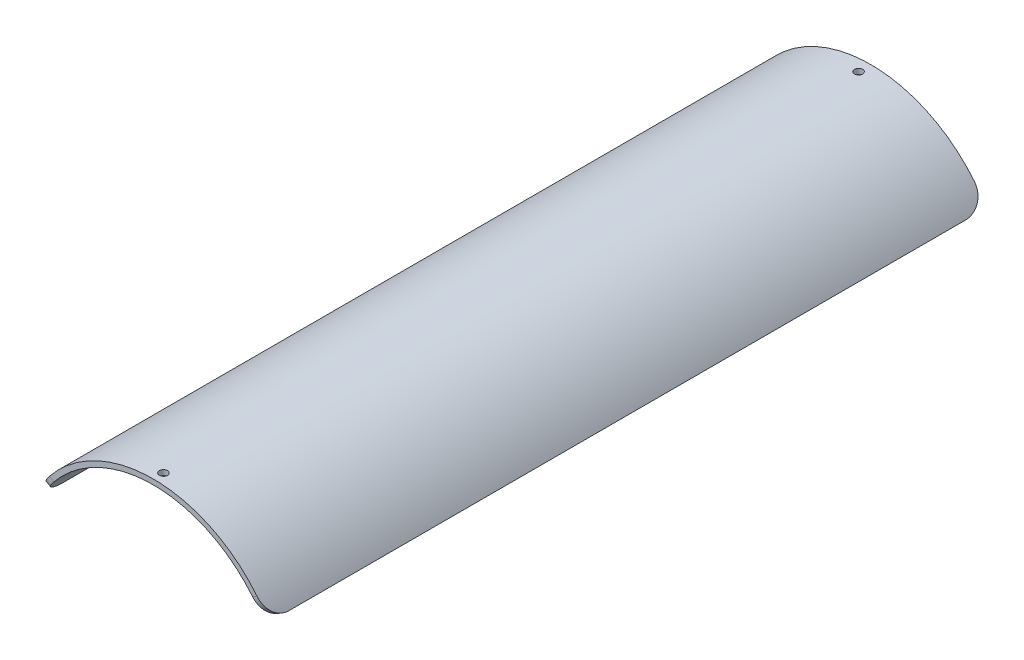
from build123d import *

# Parameters (mm, degrees)
BOSS_EXTRUDE1_DEPTH = 175
FILLET1_R           = 10
SKETCH3_R           = 2
CUT_EXTRUDE1_DEPTH  = 340


with BuildPart() as part:
    # Sketch1 → Boss-Extrude1 (new, symmetric)
    with BuildSketch(Plane.XY):
        with BuildLine():
            Line((-56.291651246, 32.5), (-54.126587737, 31.25))
            ThreePointArc((-54.126587737, 31.25), (0, 62.5), (54.126587737, 31.25))
            Line((54.126587737, 31.25), (56.291651246, 32.5))
            ThreePointArc((56.291651246, 32.5), (0, 65), (-56.291651246, 32.5))
        make_face()
    extrude(amount=BOSS_EXTRUDE1_DEPTH, both=True)

    # Fillet1
    fillet1_edges = [part.edges().sort_by_distance(p)[0] for p in [
        (55.209119491, 31.875, 175),
        (55.209119491, 31.875, -175),
        (-55.209119491, 31.875, -175),
        (-55.209119491, 31.875, 175),
    ]]
    fillet(fillet1_edges, radius=FILLET1_R)

    # Sketch3 → Cut-Extrude1 (cut)
    with BuildSketch(Plane(origin=(0, 0, 0), x_dir=(1, 0, 0), z_dir=(0, 1, 0))):
        with Locations(Location((0, -170, 0), (0, 0, 90))):
            Circle(SKETCH3_R)
        with Locations(Location((0, 169, 0), (0, 0, 90))):
            Circle(SKETCH3_R)
    extrude(amount=CUT_EXTRUDE1_DEPTH, mode=Mode.SUBTRACT)


solid = part.part
